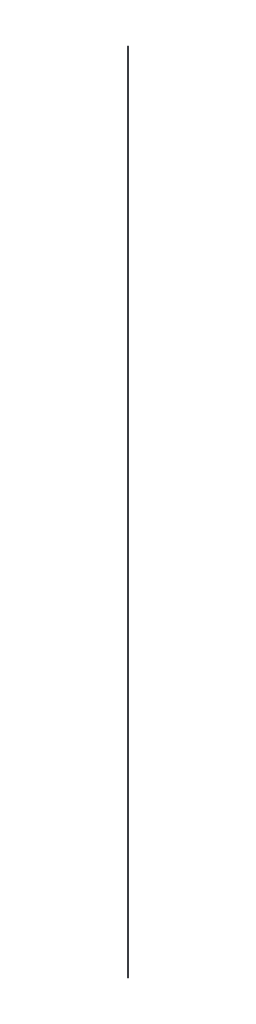
from build123d import *

# Parameters (mm, degrees)
SKETCH3_R = 0.25


with BuildPart() as part:
    # Sweep1: sweep along a path in Sketch2
    with BuildLine(Plane.XY) as sweep1_path:
        Line((0, 0), (0, 765.2))
    # Sketch3 → Sweep1 (sweep)
    with BuildSketch(Plane(origin=(0, 0, 0), x_dir=(1, 0, 0), z_dir=(0, 1, 0))):
        Circle(SKETCH3_R)
    sweep(path=sweep1_path.line)


solid = part.part
